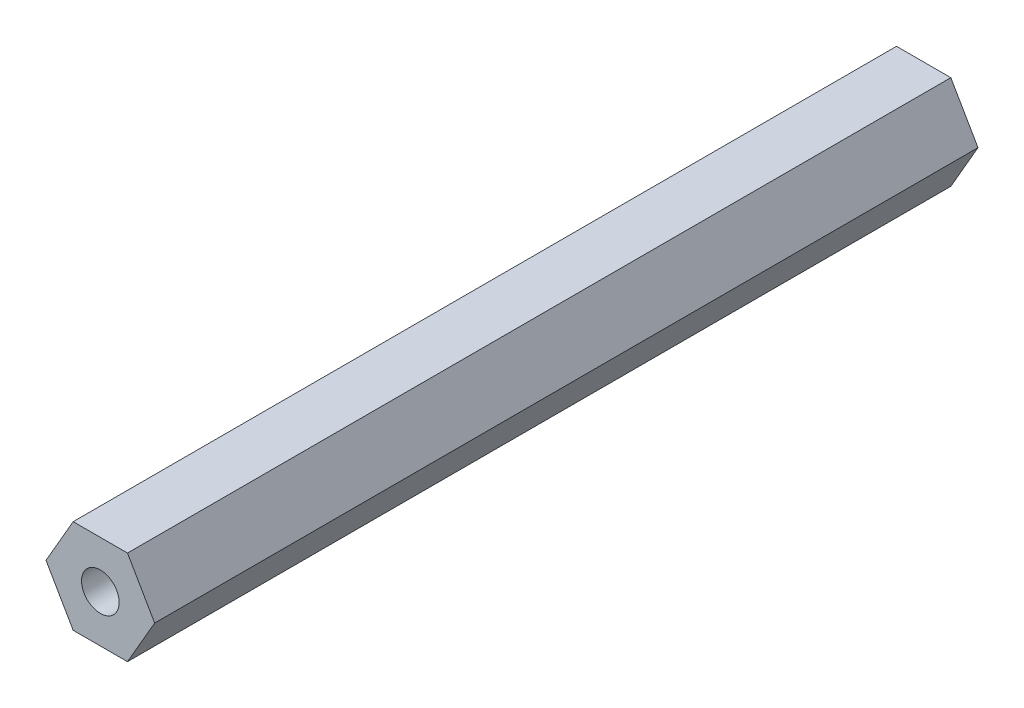
from build123d import *

# Parameters (mm, degrees)
SKETCH1_R           = 2.54
BOSS_EXTRUDE1_DEPTH = 111.125


with BuildPart() as part:
    # Sketch1 → Boss-Extrude1 (new body)
    with BuildSketch(Plane.XY):
        Polygon((7.332348419, -0.561581599), (3.666174209, 5.788418401), (-3.666174209, 5.788418401), (-7.332348419, -0.561581599), (-3.666174209, -6.911581599), (3.666174209, -6.911581599), align=None)
        with Locations((0, -0.561581599)):
            Circle(SKETCH1_R, mode=Mode.SUBTRACT)
    extrude(amount=BOSS_EXTRUDE1_DEPTH)


solid = part.part
